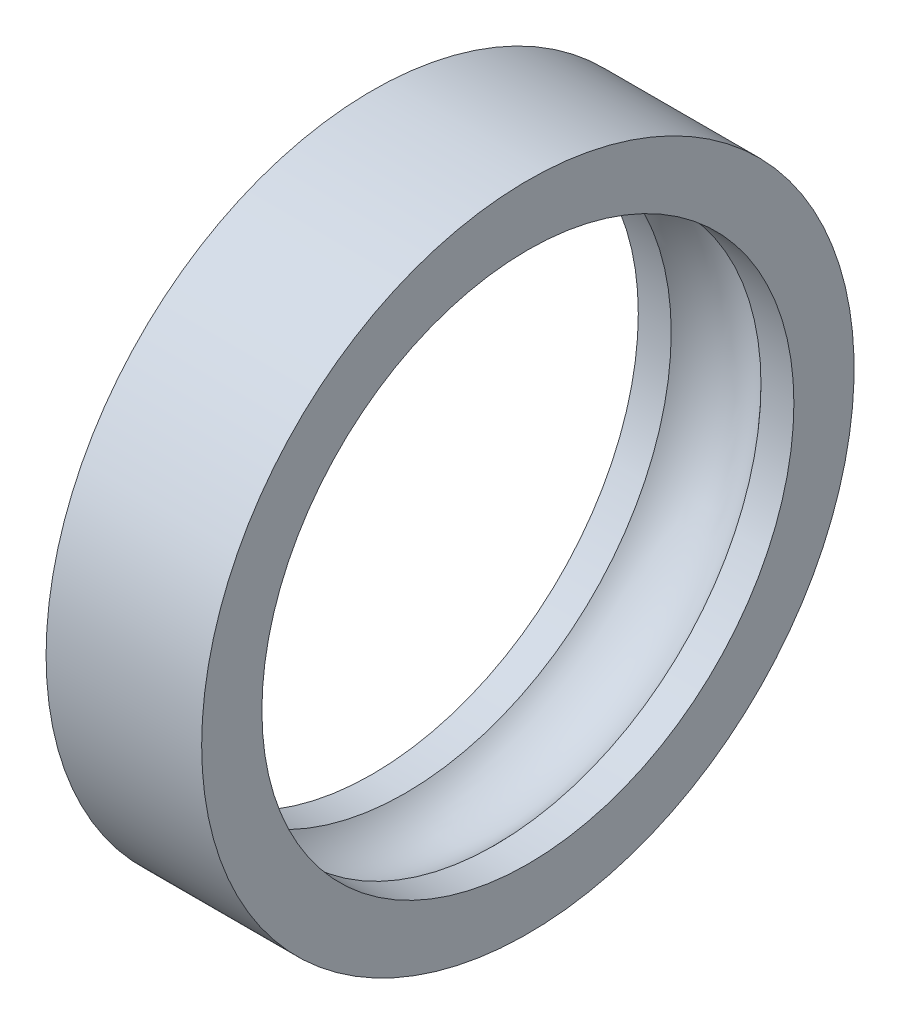
from build123d import *


with BuildPart() as part:
    # Sketch2 → Revolve1 (revolve)
    with BuildSketch(Plane.XY, mode=Mode.PRIVATE) as revolve1_sk:
        with BuildLine():
            Line((-22.706140351, 12.066885965), (8.293859649, 12.066885965))
            Line((8.293859649, 12.066885965), (8.293859649, 0.066885965))
            Line((8.293859649, 0.066885965), (1.738131559, 0.066885965))
            ThreePointArc((1.738131559, 0.066885965), (-7.206140351, 4.066885965), (-16.150412261, 0.066885965))
            Line((-16.150412261, 0.066885965), (-22.706140351, 0.066885965))
            Line((-22.706140351, 0.066885965), (-22.706140351, 12.066885965))
        make_face()
    revolve(revolve1_sk.sketch.rotate(Axis((-30.252192982, -52.933114035, 0), (1, 0, 0)), 90), axis=Axis((-30.252192982, -52.933114035, 0), (1, 0, 0)))


solid = part.part
